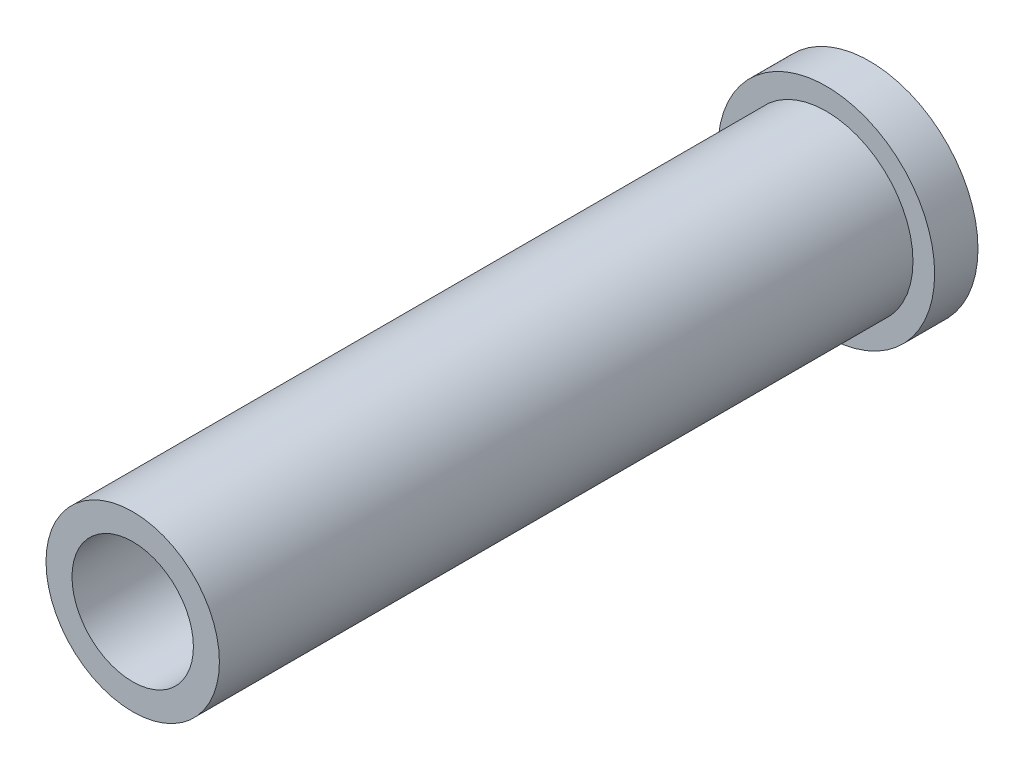
from build123d import *
from build123d.topology import SkipClean

# Parameters (mm, degrees)
SKETCH_1_R          = 2
SKETCH_1_R_2        = 1.4
EXTRUDE_1_DEPTH     = 16
SKETCH_2_R          = 2.5
EXTRUDE_2_DEPTH     = 1
CUT_EXTRUDE_1_REACH = 19.364
SKETCH_3_R          = 1.4


with BuildPart() as part:
    # 草图1 → 凸台-拉伸1 (new body)
    with BuildSketch(Plane.XY):
        Circle(SKETCH_1_R)
        Circle(SKETCH_1_R_2, mode=Mode.SUBTRACT)
    extrude(amount=EXTRUDE_1_DEPTH)

    # 草图2 → 凸台-拉伸2 (add)
    with BuildSketch(Plane(origin=(0, 0, 0), x_dir=(-1, 0, 0), z_dir=(0, 0, -1))):
        Circle(SKETCH_2_R)
    extrude(amount=EXTRUDE_2_DEPTH)

    # 草图3 → 切除-拉伸1 (cut, up to next)
    with BuildSketch(Plane(origin=(0, 0, -1), x_dir=(-1, 0, 0), z_dir=(0, 0, -1)), mode=Mode.PRIVATE) as cut_extrude_1_sk1:
        Circle(SKETCH_3_R)
    cut_extrude_1_tool1 = extrude(cut_extrude_1_sk1.sketch, amount=-CUT_EXTRUDE_1_REACH, mode=Mode.PRIVATE) & part.part
    add(cut_extrude_1_tool1.solids().sort_by_distance((0, 0, -1))[0], mode=Mode.SUBTRACT)


solid = part.part
